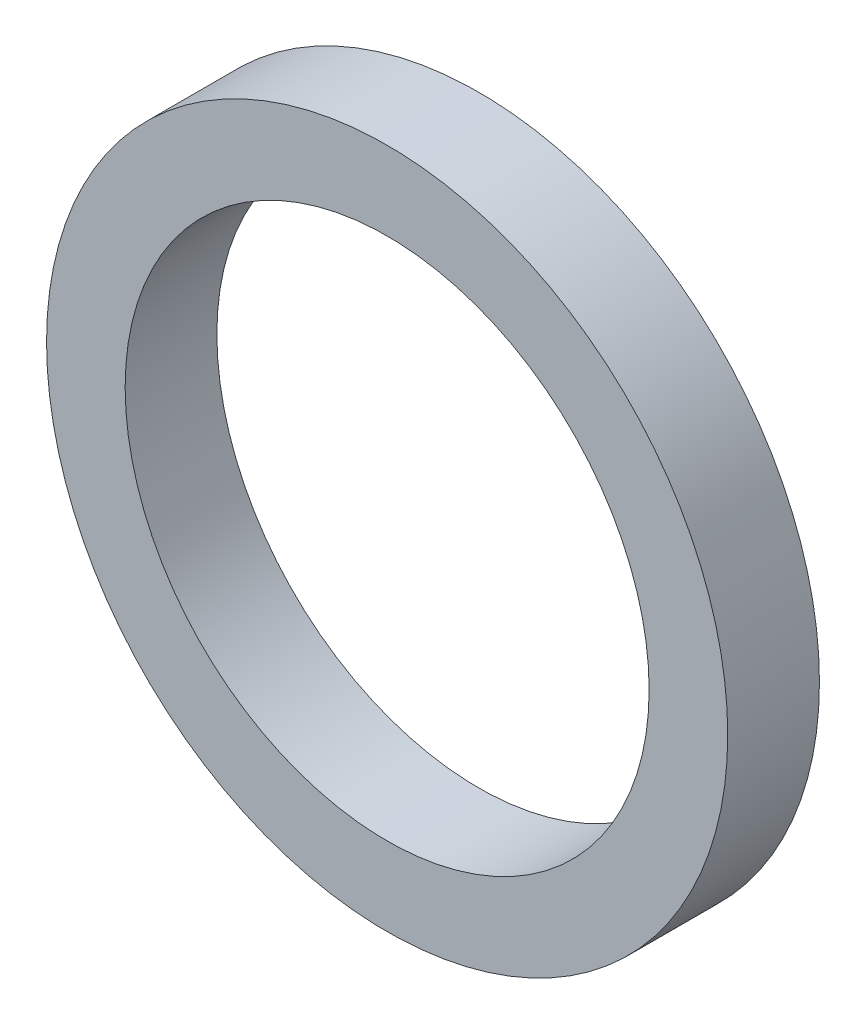
from build123d import *

# Parameters (mm, degrees)
SKETCH_1_R      = 26
SKETCH_1_R_2    = 20
EXTRUDE_1_DEPTH = 7


with BuildPart() as part:
    # 草图1 → 凸台-拉伸1 (new body)
    with BuildSketch(Plane.XY):
        Circle(SKETCH_1_R)
        Circle(SKETCH_1_R_2, mode=Mode.SUBTRACT)
    extrude(amount=EXTRUDE_1_DEPTH)


solid = part.part
